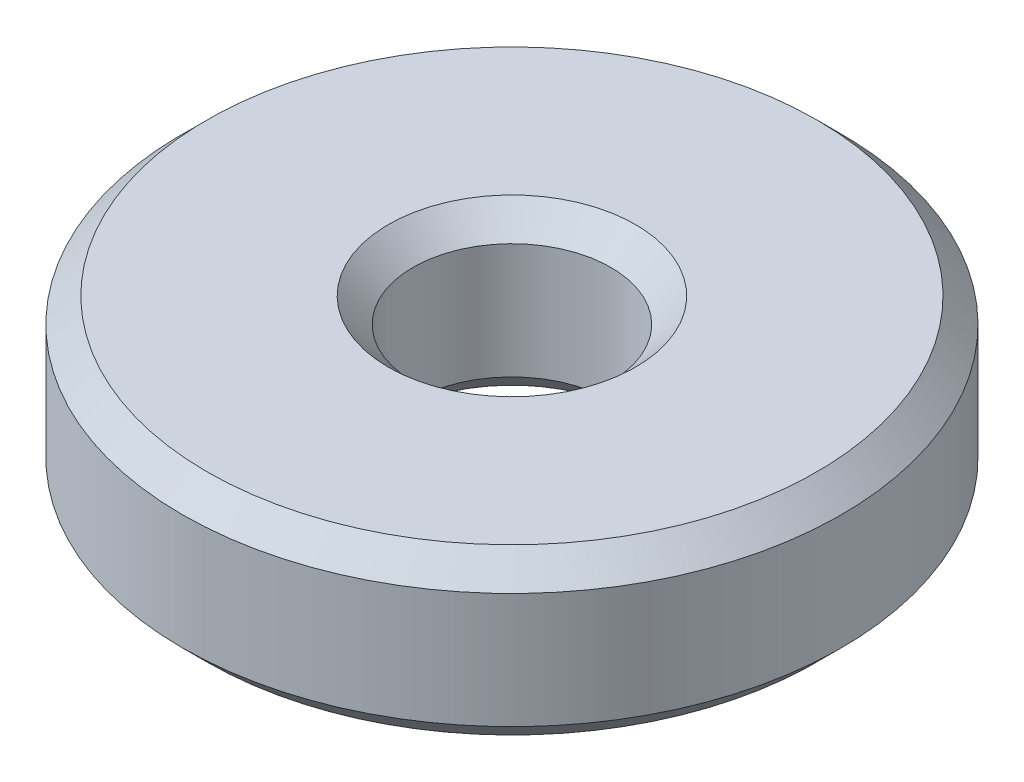
from build123d import *

# Parameters (mm, degrees)
SKETCH1_R           = 10
SKETCH1_R_2         = 3
BOSS_EXTRUDE1_DEPTH = 5
CHAMFER1_SIZE       = 0.75


with BuildPart() as part:
    # Sketch1 → Boss-Extrude1 (new body)
    with BuildSketch(Plane(origin=(0, 0, 0), x_dir=(1, 0, 0), z_dir=(0, 1, 0))):
        with Locations(Location((0, 0, 0), (0, 0, 270))):
            Circle(SKETCH1_R)
        with Locations(Location((0, 0, 0), (0, 0, 270))):
            Circle(SKETCH1_R_2, mode=Mode.SUBTRACT)
    extrude(amount=BOSS_EXTRUDE1_DEPTH)

    # Chamfer1
    chamfer1_edges = [part.edges().sort_by_distance(p)[0] for p in [
        (0, 0, -10),
        (0, 5, -10),
        (0, 0, -3),
        (0, 5, -3),
    ]]
    chamfer(chamfer1_edges, length=CHAMFER1_SIZE)


solid = part.part
